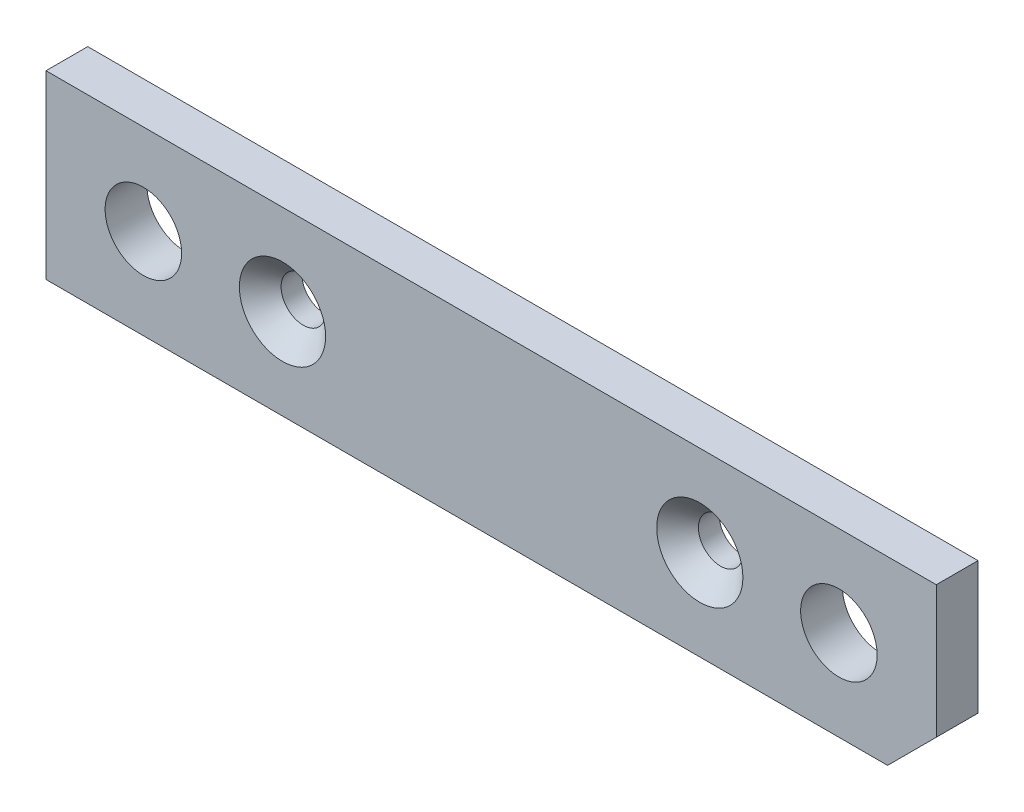
from build123d import *

# Parameters (mm, degrees)
SKETCH_1_W      = 64
SKETCH_1_H      = 13
SKETCH_1_R      = 2.75
SKETCH_1_R_2    = 1.6
EXTRUDE_1_DEPTH = 1.5
CHAMFER_1_SIZE  = 3.5
CHAMFER_2_SIZE  = 1.5


with BuildPart() as part:
    # 草图1 → 凸台-拉伸1 (new, symmetric)
    with BuildSketch(Plane.XY):
        Rectangle(SKETCH_1_W, SKETCH_1_H)
        with Locations((-25, 0)):
            Circle(SKETCH_1_R, mode=Mode.SUBTRACT)
        with Locations((25, 0)):
            Circle(SKETCH_1_R, mode=Mode.SUBTRACT)
        with Locations((-15, 0)):
            Circle(SKETCH_1_R_2, mode=Mode.SUBTRACT)
        with Locations(Location((15, 0, 0), (0, 0, 180))):
            Circle(SKETCH_1_R_2, mode=Mode.SUBTRACT)
    extrude(amount=EXTRUDE_1_DEPTH, both=True)

    # 倒角1
    chamfer_1_edges = [part.edges().sort_by_distance(p)[0] for p in [
        (32, -6.5, 0),
    ]]
    chamfer(chamfer_1_edges, length=CHAMFER_1_SIZE)

    # 倒角2
    chamfer_2_edges = [part.edges().sort_by_distance(p)[0] for p in [
        (-16.6, 0, 1.5),
        (16.6, 0, 1.5),
    ]]
    chamfer(chamfer_2_edges, length=CHAMFER_2_SIZE)


solid = part.part
